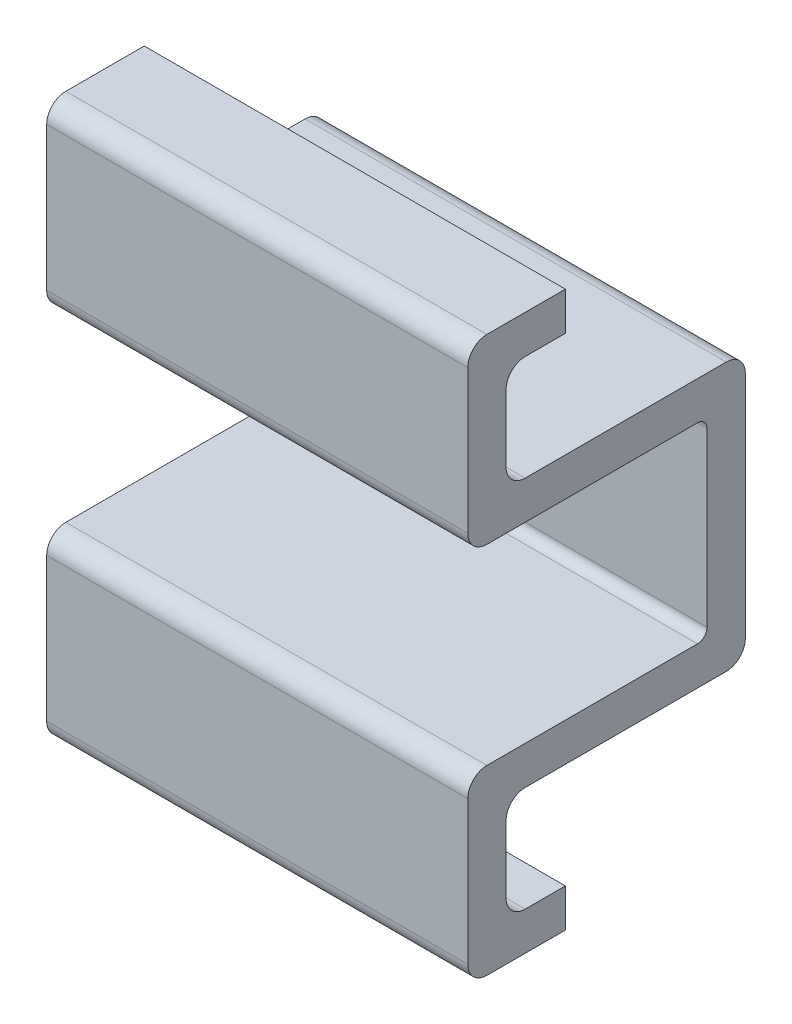
from build123d import *

# Parameters (mm, degrees)
BOSS_EXTRUDE1_DEPTH = 22
FILLET1_R           = 1
FILLET2_R           = 0.5


with BuildPart() as part:
    # Sketch3 → Boss-Extrude1 (new body)
    with BuildSketch(Plane(origin=(0, 0, 0), x_dir=(0, 0, -1), z_dir=(1, 0, 0))):
        Polygon((-3.729267548, 0), (-5.729267548, 0), (-5.729267548, -5), (-18.229267548, -5), (-18.229267548, -14.5), (-13.131696696, -14.5), (-13.131696696, -12.5), (-14.52244663, -12.5), (-16.229267548, -12.5), (-16.229267548, -7), (-3.729267548, -7), align=None)
        Polygon((-18.229267548, 5), (-5.729267548, 5), (-5.729267548, 0), (-3.729267548, 0), (-3.729267548, 7), (-16.229267548, 7), (-16.229267548, 12.5), (-14.52244663, 12.5), (-13.131696696, 12.5), (-13.131696696, 14.5), (-18.229267548, 14.5), align=None)
    extrude(amount=BOSS_EXTRUDE1_DEPTH)

    # Fillet1
    fillet1_edges = [part.edges().sort_by_distance(p)[0] for p in [
        (11, -14.5, 18.229267548),
        (11, -5, 18.229267548),
        (11, 5, 18.229267548),
        (11, 14.5, 18.229267548),
        (11, 12.5, 16.229267548),
        (11, 7, 16.229267548),
        (11, 7, 3.729267548),
        (11, -7, 3.729267548),
        (11, -7, 16.229267548),
        (11, -12.5, 16.229267548),
    ]]
    fillet(fillet1_edges, radius=FILLET1_R)

    # Fillet2
    fillet2_edges = [part.edges().sort_by_distance(p)[0] for p in [
        (11, -5, 5.729267548),
        (11, 5, 5.729267548),
    ]]
    fillet(fillet2_edges, radius=FILLET2_R)


solid = part.part
